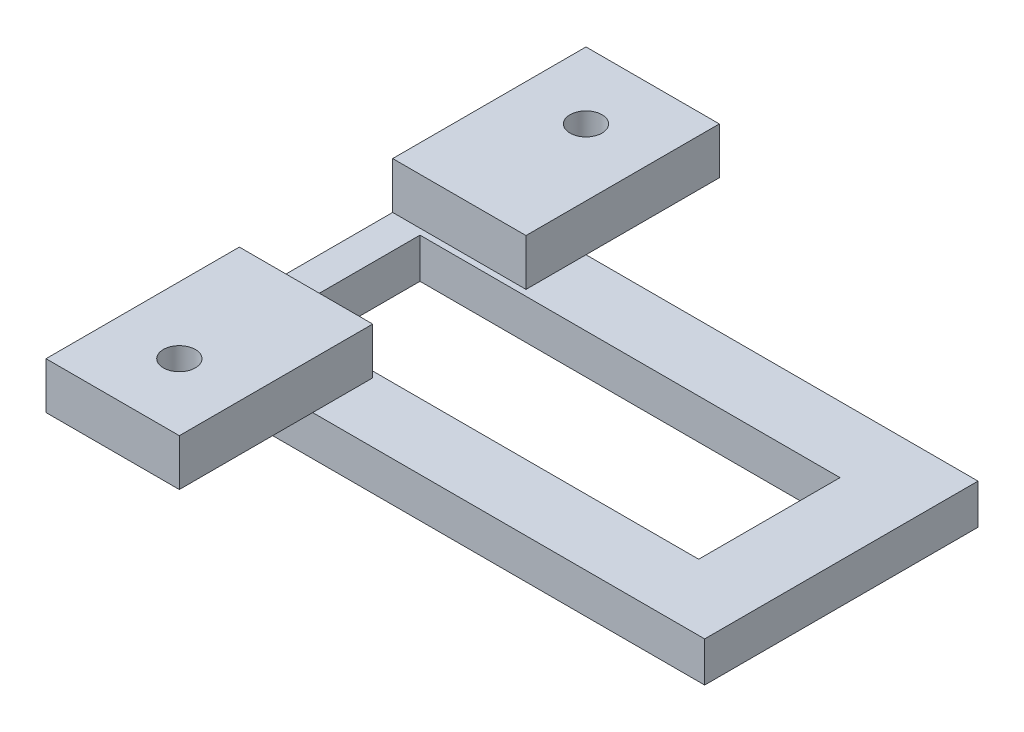
from build123d import *

# Parameters (mm, degrees)
SKETCH1_W                                       = 39.4
SKETCH1_H                                       = 20.5
BOSS_EXTRUDE1_DEPTH                             = 3
SKETCH3_W                                       = 28.6
SKETCH3_H                                       = 10.6
CUT_EXTRUDE1_DEPTH                              = 3
SKETCH4_W                                       = 10
SKETCH4_H                                       = 4.5
BOSS_EXTRUDE2_DEPTH                             = 3.5
SKETCH5_W                                       = 10
SKETCH5_H                                       = 3.5
BOSS_EXTRUDE3_DEPTH                             = 10
SKETCH6_W                                       = 10
SKETCH6_H                                       = 3.5
BOSS_EXTRUDE4_DEPTH                             = 10
CSK_FOR_M2_FLAT_HEAD_MACHINE_SCREW1_D           = 2.4
CSK_FOR_M2_FLAT_HEAD_MACHINE_SCREW1_CSINK_D     = 4.4
CSK_FOR_M2_FLAT_HEAD_MACHINE_SCREW1_CSINK_ANGLE = 90
CSK_FOR_M2_FLAT_HEAD_MACHINE_SCREW2_D           = 2.4
CSK_FOR_M2_FLAT_HEAD_MACHINE_SCREW2_CSINK_D     = 4.4
CSK_FOR_M2_FLAT_HEAD_MACHINE_SCREW2_CSINK_ANGLE = 90
SKETCH16_W                                      = 2.9
SKETCH16_H                                      = 10.6
CUT_EXTRUDE2_DEPTH                              = 3


with BuildPart() as part:
    # Sketch1 → Boss-Extrude1 (new body)
    with BuildSketch(Plane(origin=(0, 0, 0), x_dir=(1, 0, 0), z_dir=(0, 1, 0))):
        Rectangle(SKETCH1_W, SKETCH1_H)
    extrude(amount=BOSS_EXTRUDE1_DEPTH)

    # Sketch3 → Cut-Extrude1 (cut)
    with BuildSketch(Plane(origin=(0, 3, 0), x_dir=(1, 0, 0), z_dir=(0, 1, 0))):
        Rectangle(SKETCH3_W, SKETCH3_H)
    extrude(amount=-CUT_EXTRUDE1_DEPTH, mode=Mode.SUBTRACT)

    # Sketch4 → Boss-Extrude2 (add)
    with BuildSketch(Plane(origin=(0, 3, 0), x_dir=(1, 0, 0), z_dir=(0, 1, 0))):
        with Locations((-14.7, 8)):
            Rectangle(SKETCH4_W, SKETCH4_H)
        with Locations((-14.7, -8)):
            Rectangle(SKETCH4_W, SKETCH4_H)
    extrude(amount=BOSS_EXTRUDE2_DEPTH)

    # Sketch5 → Boss-Extrude3 (add)
    with BuildSketch(Plane.XY.offset(10.25)):
        with Locations((-14.7, 4.75)):
            Rectangle(SKETCH5_W, SKETCH5_H)
    extrude(amount=BOSS_EXTRUDE3_DEPTH)

    # Sketch6 → Boss-Extrude4 (add)
    with BuildSketch(Plane(origin=(0, 0, -10.25), x_dir=(-1, 0, 0), z_dir=(0, 0, -1))):
        with Locations((14.7, 4.75)):
            Rectangle(SKETCH6_W, SKETCH6_H)
    extrude(amount=BOSS_EXTRUDE4_DEPTH)

    # CSK for M2 Flat Head Machine Screw1 (through all)
    with Locations(Plane(origin=(0, 3, 0), x_dir=(-1, 0, 0), z_dir=(0, -1, 0))):
        with Locations((14.7, 15.25)):
            CounterSinkHole(CSK_FOR_M2_FLAT_HEAD_MACHINE_SCREW1_D / 2, CSK_FOR_M2_FLAT_HEAD_MACHINE_SCREW1_CSINK_D / 2, counter_sink_angle=CSK_FOR_M2_FLAT_HEAD_MACHINE_SCREW1_CSINK_ANGLE)

    # CSK for M2 Flat Head Machine Screw2 (through all)
    with Locations(Plane(origin=(0, 3, 0), x_dir=(-1, 0, 0), z_dir=(0, -1, 0))):
        with Locations((14.7, -15.25)):
            CounterSinkHole(CSK_FOR_M2_FLAT_HEAD_MACHINE_SCREW2_D / 2, CSK_FOR_M2_FLAT_HEAD_MACHINE_SCREW2_CSINK_D / 2, counter_sink_angle=CSK_FOR_M2_FLAT_HEAD_MACHINE_SCREW2_CSINK_ANGLE)

    # Sketch16 → Cut-Extrude2 (cut)
    with BuildSketch(Plane(origin=(0, 3, 0), x_dir=(1, 0, 0), z_dir=(0, 1, 0))):
        with Locations((-15.75, 0)):
            Rectangle(SKETCH16_W, SKETCH16_H)
    extrude(amount=-CUT_EXTRUDE2_DEPTH, mode=Mode.SUBTRACT)


solid = part.part
